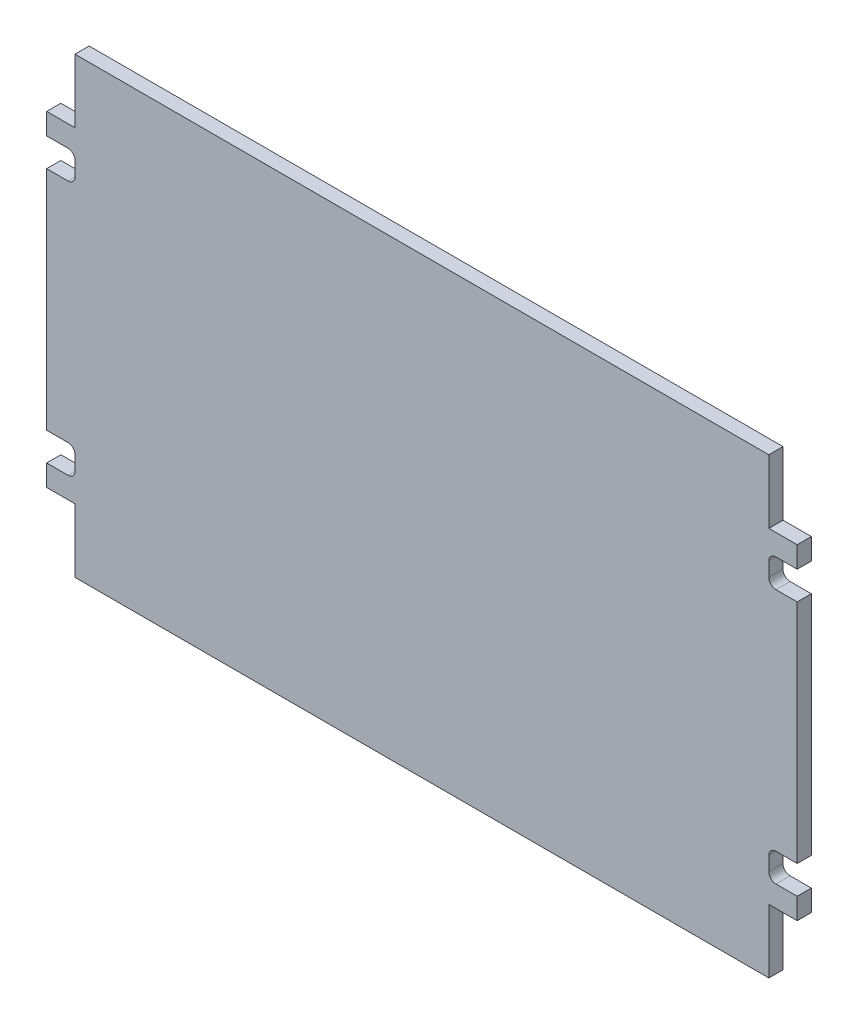
from build123d import *

# Parameters (mm, degrees)
SKETCH1_W           = 106
SKETCH1_H           = 64
BOSS_EXTRUDE1_DEPTH = 2
SKETCH2_W           = 4
SKETCH2_H           = 9
CUT_EXTRUDE1_DEPTH  = 124.838604643
CUT_EXTRUDE2_DEPTH  = 124.838604643


with BuildPart() as part:
    # Sketch1 → Boss-Extrude1 (new body)
    with BuildSketch(Plane.XY):
        with Locations((53, 32)):
            Rectangle(SKETCH1_W, SKETCH1_H)
    extrude(amount=BOSS_EXTRUDE1_DEPTH)

    # Sketch2 → Cut-Extrude1 (cut, through all)
    with BuildSketch(Plane.XY.offset(2)):
        with Locations((2, 59.5)):
            Rectangle(SKETCH2_W, SKETCH2_H)
        with Locations((2, 4.5)):
            Rectangle(SKETCH2_W, SKETCH2_H)
        with Locations((104, 4.5)):
            Rectangle(SKETCH2_W, SKETCH2_H)
        with Locations((104, 59.5)):
            Rectangle(SKETCH2_W, SKETCH2_H)
    extrude(amount=-CUT_EXTRUDE1_DEPTH, mode=Mode.SUBTRACT)

    # Sketch3 → Cut-Extrude2 (cut, through all)
    with BuildSketch(Plane.XY.offset(2)):
        with BuildLine():
            Line((106, 12), (103, 12))
            ThreePointArc((103, 12), (102.292893219, 12.292893219), (102, 13))
            Line((102, 13), (102, 15))
            ThreePointArc((102, 15), (102.292893219, 15.707106781), (103, 16))
            Line((103, 16), (106, 16))
            Line((106, 16), (106, 12))
        make_face()
        with BuildLine():
            Line((0, 12), (3, 12))
            ThreePointArc((3, 12), (3.707106781, 12.292893219), (4, 13))
            Line((4, 13), (4, 15))
            ThreePointArc((4, 15), (3.707106781, 15.707106781), (3, 16))
            Line((3, 16), (0, 16))
            Line((0, 16), (0, 12))
        make_face()
        with BuildLine():
            Line((0, 52), (3, 52))
            ThreePointArc((3, 52), (3.707106781, 51.707106781), (4, 51))
            Line((4, 51), (4, 49))
            ThreePointArc((4, 49), (3.707106781, 48.292893219), (3, 48))
            Line((3, 48), (0, 48))
            Line((0, 48), (0, 52))
        make_face()
        with BuildLine():
            Line((106, 52), (103, 52))
            ThreePointArc((103, 52), (102.292893219, 51.707106781), (102, 51))
            Line((102, 51), (102, 49))
            ThreePointArc((102, 49), (102.292893219, 48.292893219), (103, 48))
            Line((103, 48), (106, 48))
            Line((106, 48), (106, 52))
        make_face()
    extrude(amount=-CUT_EXTRUDE2_DEPTH, mode=Mode.SUBTRACT)


solid = part.part
